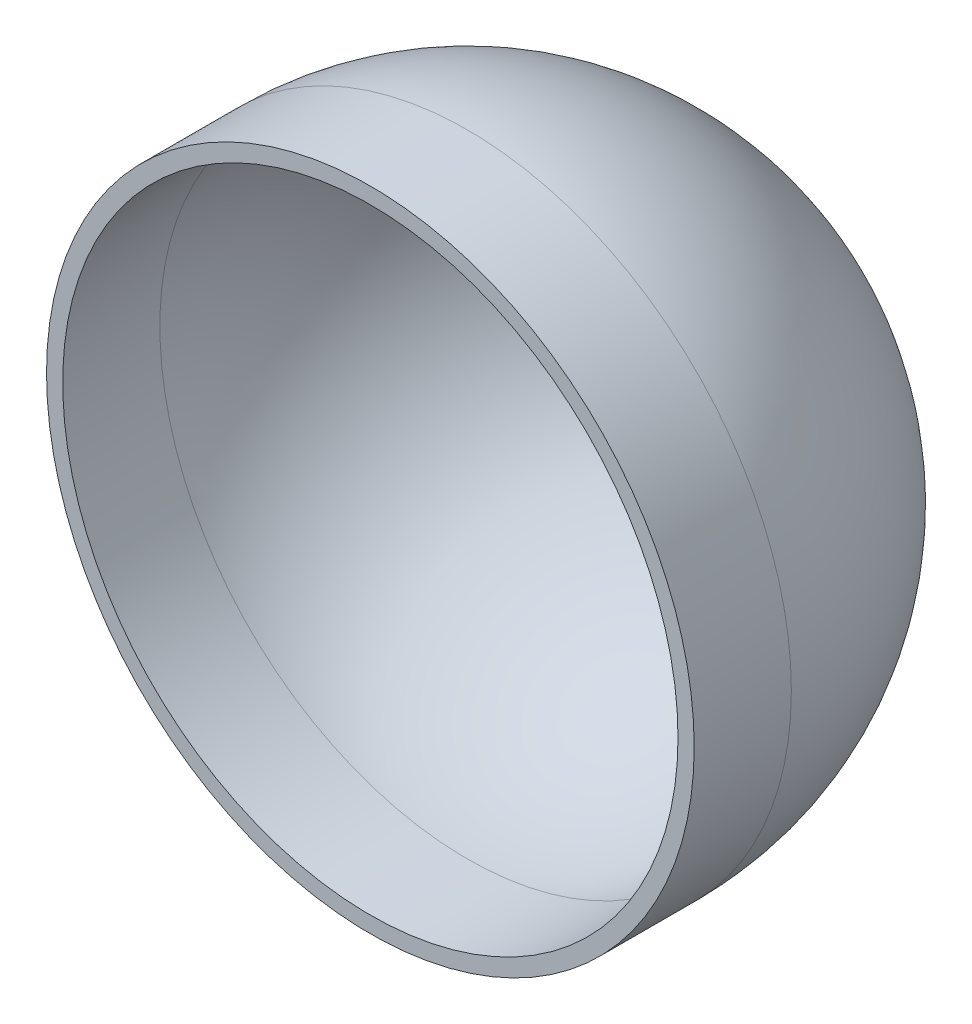
from build123d import *

# Parameters (mm, degrees)
SKETCH_4_R      = 100
SKETCH_4_R_2    = 95
EXTRUDE_1_DEPTH = 30


with BuildPart() as part:
    # 草图2 → 旋转1 (revolve)
    with BuildSketch(Plane(origin=(0, 0, 0), x_dir=(1, 0, 0), z_dir=(0, 1, 0))):
        with BuildLine():
            Line((100, 0), (95, 0))
            ThreePointArc((95, 0), (67.175144213, 67.175144213), (0, 95))
            Line((0, 95), (0, 100))
            ThreePointArc((0, 100), (70.710678119, 70.710678119), (100, 0))
        make_face()
    revolve(axis=Axis((0, 0, -95), (0, 0, -1)))

    # 草图4 → 凸台-拉伸1 (add)
    with BuildSketch(Plane.XY):
        Circle(SKETCH_4_R)
        Circle(SKETCH_4_R_2, mode=Mode.SUBTRACT)
    extrude(amount=EXTRUDE_1_DEPTH)


solid = part.part
